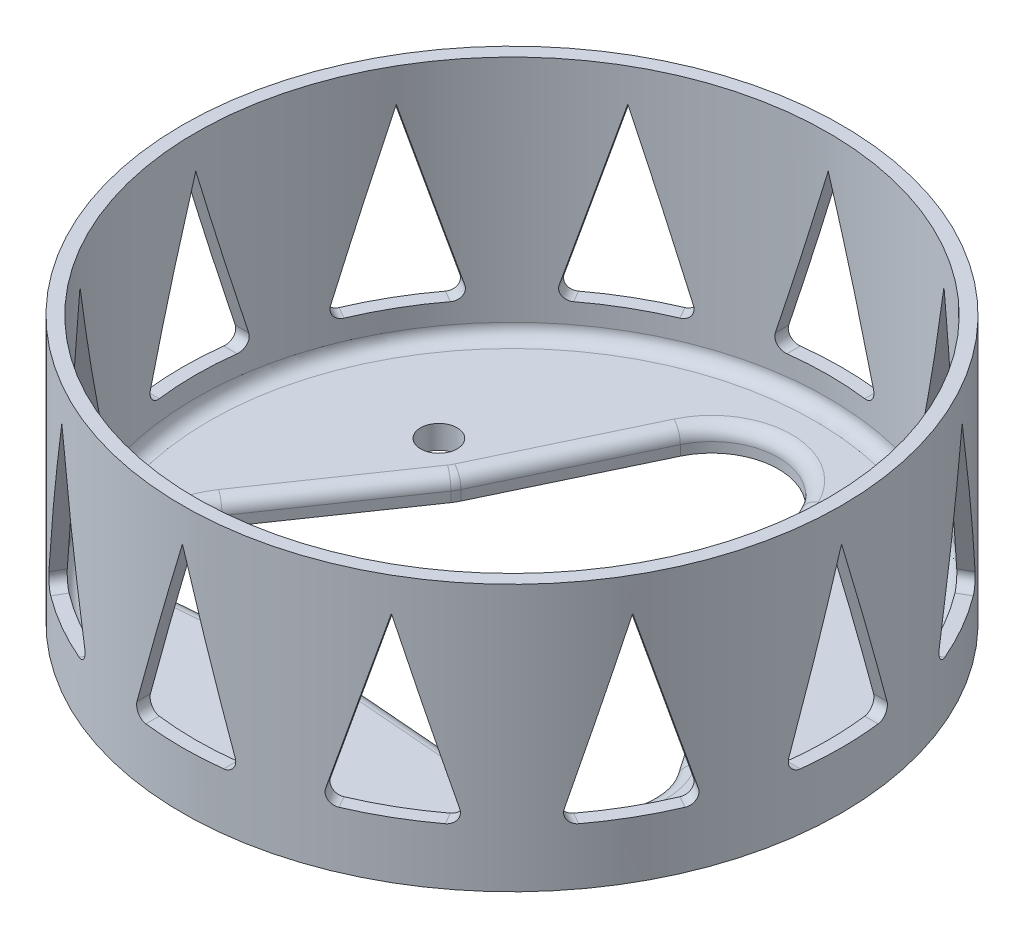
from build123d import *

# Parameters (mm, degrees)
SKETCH_3_R                       = 2.75
CUT_EXTRUDE_4_DEPTH              = 81.625678292
CUT_EXTRUDE_5_DEPTH              = 81.625678292
CUT_EXTRUDE_6_DEPTH              = 81.625678292
FILLET_3_R                       = 1.6
PATTERN_CIRCULAR_1_COUNT         = 12
FILLET_3_OF_PATTERN_CIRCULAR_1_R = 1.6
FILLET_1_R                       = 2
FILLET_2_R                       = 2


with BuildPart() as part:
    # Эскиз2 → Повернуть1 (revolve)
    with BuildSketch(Plane.XY):
        Polygon((0, 0), (49.5, 0), (49.5, 40), (47.5, 40), (47.5, 3.5), (0, 3.5), align=None)
    revolve(axis=Axis((0, -1536.090943624, 0), (0, 1, 0)))

    # Эскиз3 → Вырез-Вытянуть4 (cut, through all)
    with BuildSketch(Plane(origin=(0, 0, 0), x_dir=(1, 0, 0), z_dir=(0, 1, 0))):
        with Locations(Location((0, -30, 0), (0, 0, 270))):
            Circle(SKETCH_3_R)
        with Locations(Location((-25.980762114, 15, 0), (0, 0, 270))):
            Circle(SKETCH_3_R)
        with Locations(Location((25.980762114, 15, 0), (0, 0, 270))):
            Circle(SKETCH_3_R)
    extrude(amount=CUT_EXTRUDE_4_DEPTH, mode=Mode.SUBTRACT)

    # Эскиз6 → Вырез-Вытянуть5 (cut, through all)
    with BuildSketch(Plane.XZ):
        with BuildLine():
            Line((-0.551419113, 23.021752587), (-25.193020524, 24.968924876))
            ThreePointArc((-25.193020524, 24.968924876), (-34.641016151, 20), (-34.22023351, 9.333333333))
            Line((-34.22023351, 9.333333333), (-20.213132136, -11.033333333))
            ThreePointArc((-20.213132136, -11.033333333), (-19.918584287, -11.5), (-19.661713023, -11.988419253))
            Line((-19.661713023, -11.988419253), (-9.027212986, -34.30225821))
            ThreePointArc((-9.027212986, -34.30225821), (0, -40), (9.027212986, -34.30225821))
            Line((9.027212986, -34.30225821), (19.661713023, -11.988419253))
            ThreePointArc((19.661713023, -11.988419253), (19.918584287, -11.5), (20.213132136, -11.033333333))
            Line((20.213132136, -11.033333333), (34.22023351, 9.333333333))
            ThreePointArc((34.22023351, 9.333333333), (34.641016151, 20), (25.193020524, 24.968924876))
            Line((25.193020524, 24.968924876), (0.551419113, 23.021752587))
            ThreePointArc((0.551419113, 23.021752587), (0, 23), (-0.551419113, 23.021752587))
        make_face()
    extrude(amount=-CUT_EXTRUDE_5_DEPTH, mode=Mode.SUBTRACT)

    # Эскиз7 → Вырез-Вытянуть6 (cut, through all)
    with BuildSketch(Plane.XY):
        Polygon((-8, 8.5), (8, 8.5), (0, 35), align=None)
    cut_extrude_6 = extrude(amount=-CUT_EXTRUDE_6_DEPTH, mode=Mode.SUBTRACT)

    # Скругление3
    fillet_3_edges = [part.edges().sort_by_distance(p)[0] for p in [
        (-8, 8.5, -47.835363681),
        (8, 8.5, -47.835363681),
    ]]
    fillet(fillet_3_edges, radius=FILLET_3_R)

    # Круговой массив1: Вырез-Вытянуть6 ×12 about axis
    pattern_circular_1_axis = Axis((0, 0, 0), (0, 1, 0))
    for i in range(1, PATTERN_CIRCULAR_1_COUNT):
        add(cut_extrude_6.rotate(pattern_circular_1_axis, i * 360 / PATTERN_CIRCULAR_1_COUNT), mode=Mode.SUBTRACT)

    # Скругление3 of Круговой массив1
    fillet_3_of_pattern_circular_1_edges = [part.edges().sort_by_distance(p)[0] for p in [
        (-30.845885071, 8.5, -37.426640147),
        (-16.98947861, 8.5, -45.426640147),
        (-45.426640147, 8.5, -16.98947861),
        (-37.426640147, 8.5, -30.845885071),
        (-47.835363681, 8.5, 8),
        (-47.835363681, 8.5, -8),
        (-37.426640147, 8.5, 30.845885071),
        (-45.426640147, 8.5, 16.98947861),
        (-16.98947861, 8.5, 45.426640147),
        (-30.845885071, 8.5, 37.426640147),
        (8, 8.5, 47.835363681),
        (-8, 8.5, 47.835363681),
        (30.845885071, 8.5, 37.426640147),
        (16.98947861, 8.5, 45.426640147),
        (45.426640147, 8.5, 16.98947861),
        (37.426640147, 8.5, 30.845885071),
        (47.835363681, 8.5, -8),
        (47.835363681, 8.5, 8),
        (37.426640147, 8.5, -30.845885071),
        (45.426640147, 8.5, -16.98947861),
        (16.98947861, 8.5, -45.426640147),
        (30.845885071, 8.5, -37.426640147),
    ]]
    fillet(fillet_3_of_pattern_circular_1_edges, radius=FILLET_3_OF_PATTERN_CIRCULAR_1_R)

    # Скругление1
    fillet_1_edges = [part.edges().sort_by_distance(p)[0] for p in [
        (-47.5, 3.5, 0),
    ]]
    fillet(fillet_1_edges, radius=FILLET_1_R)

    # Скругление2
    fillet_2_edges = [part.edges().sort_by_distance(p)[0] for p in [
        (34.641016151, 3.5, 20),
        (12.872219818, 3.5, 23.995338731),
        (0, 3.5, 23),
        (-12.872219818, 3.5, 23.995338731),
        (-34.641016151, 3.5, 20),
        (-27.216682823, 3.5, -0.85),
        (-19.918584287, 3.5, -11.5),
        (-14.344463005, 3.5, -23.145338731),
        (0, 3.5, -40),
        (14.344463005, 3.5, -23.145338731),
        (19.918584287, 3.5, -11.5),
        (27.216682823, 3.5, -0.85),
    ]]
    fillet(fillet_2_edges, radius=FILLET_2_R)


solid = part.part
